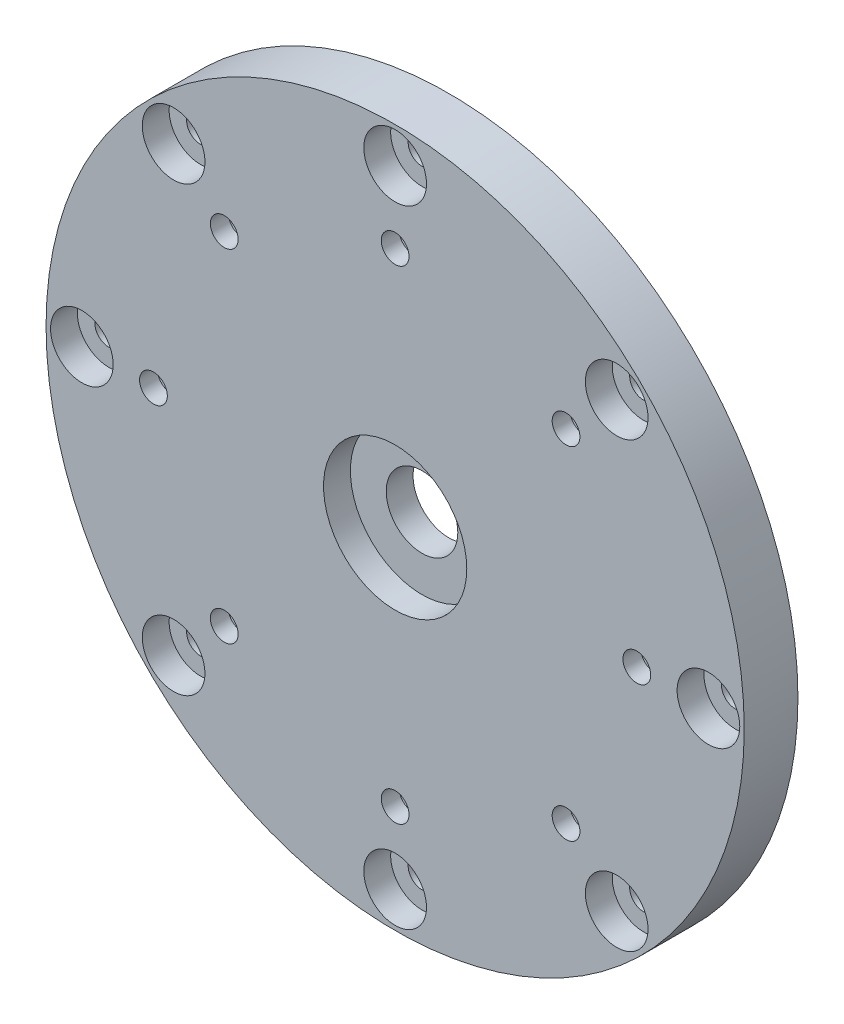
from build123d import *

# Parameters (mm, degrees)
SKETCH1_R           = 39
SKETCH1_R_2         = 1.55
SKETCH1_R_3         = 4
BOSS_EXTRUDE2_DEPTH = 6
SKETCH2_R           = 8
CUT_EXTRUDE1_DEPTH  = 3
SKETCH3_R           = 3.5
CUT_EXTRUDE2_DEPTH  = 4
SKETCH4_R           = 3.5
CUT_EXTRUDE3_DEPTH  = 3


with BuildPart() as part:
    # Sketch1 → Boss-Extrude2 (new body)
    with BuildSketch(Plane.XY):
        Circle(SKETCH1_R)
        with Locations((-27, 0)):
            Circle(SKETCH1_R_2, mode=Mode.SUBTRACT)
        with Locations((-19.091883092, 19.091883092)):
            Circle(SKETCH1_R_2, mode=Mode.SUBTRACT)
        with Locations((0, 27)):
            Circle(SKETCH1_R_2, mode=Mode.SUBTRACT)
        with Locations((19.091883092, 19.091883092)):
            Circle(SKETCH1_R_2, mode=Mode.SUBTRACT)
        with Locations((27, 0)):
            Circle(SKETCH1_R_2, mode=Mode.SUBTRACT)
        with Locations((19.091883092, -19.091883092)):
            Circle(SKETCH1_R_2, mode=Mode.SUBTRACT)
        with Locations((0, -27)):
            Circle(SKETCH1_R_2, mode=Mode.SUBTRACT)
        with Locations((-19.091883092, -19.091883092)):
            Circle(SKETCH1_R_2, mode=Mode.SUBTRACT)
        Circle(SKETCH1_R_3, mode=Mode.SUBTRACT)
        with Locations((-35, 0)):
            Circle(SKETCH1_R_2, mode=Mode.SUBTRACT)
        with Locations((-24.748737342, 24.748737342)):
            Circle(SKETCH1_R_2, mode=Mode.SUBTRACT)
        with Locations((0, 35)):
            Circle(SKETCH1_R_2, mode=Mode.SUBTRACT)
        with Locations((24.748737342, 24.748737342)):
            Circle(SKETCH1_R_2, mode=Mode.SUBTRACT)
        with Locations((35, 0)):
            Circle(SKETCH1_R_2, mode=Mode.SUBTRACT)
        with Locations((24.748737342, -24.748737342)):
            Circle(SKETCH1_R_2, mode=Mode.SUBTRACT)
        with Locations((0, -35)):
            Circle(SKETCH1_R_2, mode=Mode.SUBTRACT)
        with Locations((-24.748737342, -24.748737342)):
            Circle(SKETCH1_R_2, mode=Mode.SUBTRACT)
    extrude(amount=BOSS_EXTRUDE2_DEPTH)

    # Sketch2 → Cut-Extrude1 (cut)
    with BuildSketch(Plane.XY.offset(6)):
        Circle(SKETCH2_R)
    extrude(amount=-CUT_EXTRUDE1_DEPTH, mode=Mode.SUBTRACT)

    # Sketch3 → Cut-Extrude2 (cut)
    with BuildSketch(Plane(origin=(0, 0, 0), x_dir=(-1, 0, 0), z_dir=(0, 0, -1))):
        with Locations((0, 27)):
            Circle(SKETCH3_R)
        with Locations((19.091883092, 19.091883092)):
            Circle(SKETCH3_R)
        with Locations((27, 0)):
            Circle(SKETCH3_R)
        with Locations((19.091883092, -19.091883092)):
            Circle(SKETCH3_R)
        with Locations((0, -27)):
            Circle(SKETCH3_R)
        with Locations((-19.091883092, -19.091883092)):
            Circle(SKETCH3_R)
        with Locations((-27, 0)):
            Circle(SKETCH3_R)
        with Locations((-19.091883092, 19.091883092)):
            Circle(SKETCH3_R)
    extrude(amount=-CUT_EXTRUDE2_DEPTH, mode=Mode.SUBTRACT)

    # Sketch4 → Cut-Extrude3 (cut)
    with BuildSketch(Plane.XY.offset(6)):
        with Locations((-35, 0)):
            Circle(SKETCH4_R)
        with Locations((-24.748737342, 24.748737342)):
            Circle(SKETCH4_R)
        with Locations((0, 35)):
            Circle(SKETCH4_R)
        with Locations((24.748737342, 24.748737342)):
            Circle(SKETCH4_R)
        with Locations((35, 0)):
            Circle(SKETCH4_R)
        with Locations((24.748737342, -24.748737342)):
            Circle(SKETCH4_R)
        with Locations((0, -35)):
            Circle(SKETCH4_R)
        with Locations((-24.748737342, -24.748737342)):
            Circle(SKETCH4_R)
    extrude(amount=-CUT_EXTRUDE3_DEPTH, mode=Mode.SUBTRACT)


solid = part.part
